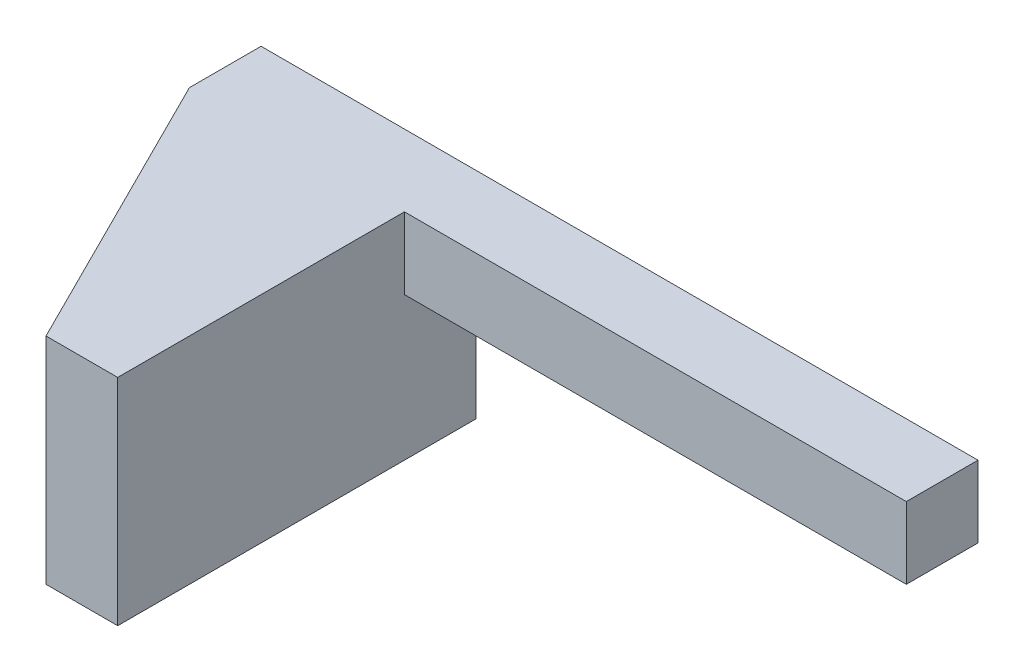
from build123d import *

# Parameters (mm, degrees)
BOSS_EXTRU_1_DEPTH           = 15
ENL_V_MAT_EXTRU_1_DEPTH      = 56.901699437
ENL_V_MAT_EXTRU_1_DEPTH_BACK = 56.901699437
ESQUISSE2_W                  = 35
ESQUISSE2_H                  = 10


with BuildPart() as part:
    # Esquisse1 → Boss.-Extru.1 (new body)
    with BuildSketch(Plane(origin=(0, 0, 0), x_dir=(1, 0, 0), z_dir=(0, 1, 0))):
        Polygon((0, 0), (-50, 0), (-50, -5), (-40, -25), (-35, -25), (-35, -5), (0, -5), align=None)
    extrude(amount=BOSS_EXTRU_1_DEPTH)

    # Esquisse2 → Enlèv. mat.-Extru.1 (cut, two sides: drawn at the far end of the back side and taken through both)
    with BuildSketch(Plane.XY.offset(5).offset(-ENL_V_MAT_EXTRU_1_DEPTH_BACK)):
        with Locations((-17.5, 5)):
            Rectangle(ESQUISSE2_W, ESQUISSE2_H)
    extrude(amount=ENL_V_MAT_EXTRU_1_DEPTH + ENL_V_MAT_EXTRU_1_DEPTH_BACK, mode=Mode.SUBTRACT)


solid = part.part
